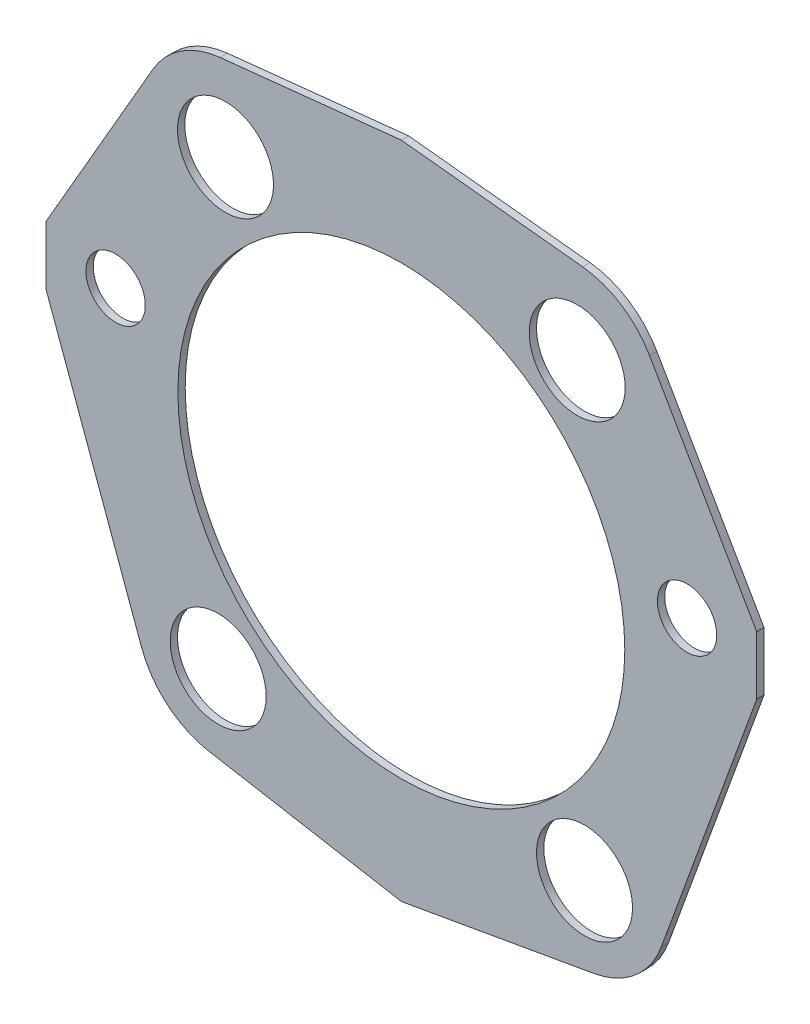
from build123d import *

# Parameters (mm, degrees)
SKETCH1_R           = 30.5
SKETCH1_R_2         = 6.55
SKETCH1_R_3         = 4.05
BOSS_EXTRUDE1_DEPTH = 1


with BuildPart() as part:
    # Sketch1 → Boss-Extrude1 (new body)
    with BuildSketch(Plane.XY):
        with BuildLine():
            Line((0, 45), (24.742465391, 42.399462096))
            ThreePointArc((24.742465391, 42.399462096), (30.023792252, 40.529246167), (33.880428677, 36.465199352))
            Line((33.880428677, 36.465199352), (48.5, 11.143359036))
            Line((48.5, 11.143359036), (48.5, 3.143359036))
            Line((48.5, 3.143359036), (35.471224905, -32.652906339))
            ThreePointArc((35.471224905, -32.652906339), (31.908364772, -37.741197937), (26.278691588, -40.366357655))
            Line((26.278691588, -40.366357655), (0, -45))
            Line((0, -45), (-26.278691588, -40.366357655))
            ThreePointArc((-26.278691588, -40.366357655), (-31.908364772, -37.741197937), (-35.471224905, -32.652906339))
            Line((-35.471224905, -32.652906339), (-48.5, 3.143359036))
            Line((-48.5, 3.143359036), (-48.5, 11.143359036))
            Line((-48.5, 11.143359036), (-33.880428677, 36.465199352))
            ThreePointArc((-33.880428677, 36.465199352), (-30.023792252, 40.529246167), (-24.742465391, 42.399462096))
            Line((-24.742465391, 42.399462096), (0, 45))
        make_face()
        Circle(SKETCH1_R, mode=Mode.SUBTRACT)
        with Locations((24, 31)):
            Circle(SKETCH1_R_2, mode=Mode.SUBTRACT)
        with Locations(Location((-24, 31, 0), (0, 0, 180))):
            Circle(SKETCH1_R_2, mode=Mode.SUBTRACT)
        with Locations((-25, -30)):
            Circle(SKETCH1_R_2, mode=Mode.SUBTRACT)
        with Locations(Location((25, -30, 0), (0, 0, 180))):
            Circle(SKETCH1_R_2, mode=Mode.SUBTRACT)
        with Locations((39, 8)):
            Circle(SKETCH1_R_3, mode=Mode.SUBTRACT)
        with Locations(Location((-39, 8, 0), (0, 0, 180))):
            Circle(SKETCH1_R_3, mode=Mode.SUBTRACT)
    extrude(amount=-BOSS_EXTRUDE1_DEPTH)


solid = part.part
